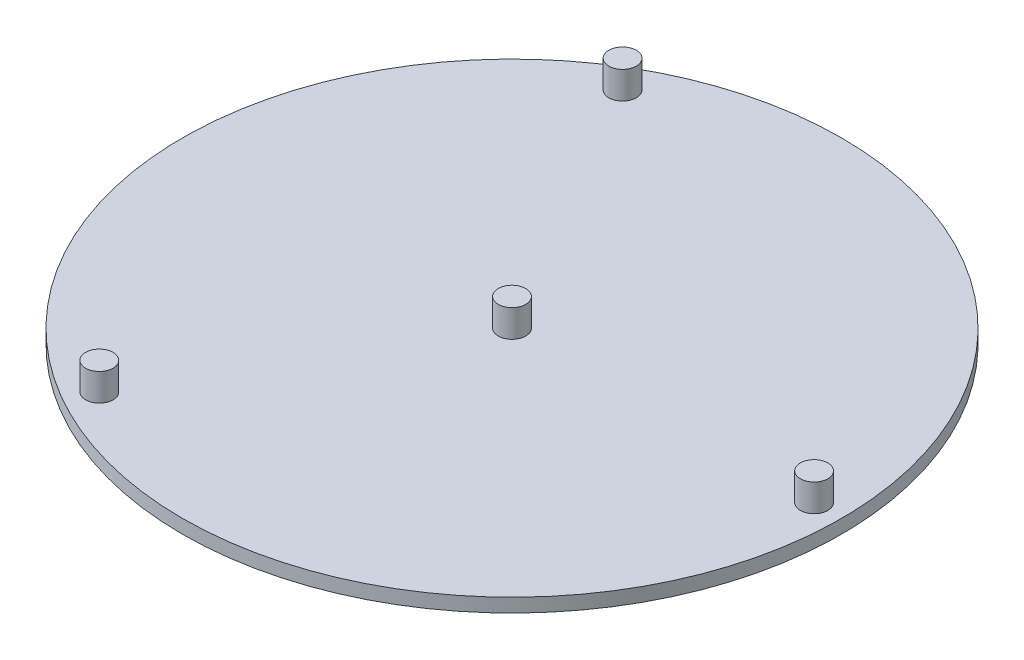
from build123d import *

# Parameters (mm, degrees)
SKETCH1_R           = 76.2
BOSS_EXTRUDE1_DEPTH = 3.175
SKETCH3_R           = 3.175
BOSS_EXTRUDE2_DEPTH = 6.35
CIRPATTERN1_COUNT   = 3


with BuildPart() as part:
    # Sketch1 → Boss-Extrude1 (new body)
    with BuildSketch(Plane(origin=(0, 0, 0), x_dir=(1, 0, 0), z_dir=(0, 1, 0))):
        with Locations(Location((0, 0, 0), (0, 0, 270))):
            Circle(SKETCH1_R)
    extrude(amount=BOSS_EXTRUDE1_DEPTH)

    # Sketch3 → Boss-Extrude2 (add)
    with BuildSketch(Plane(origin=(0, 3.175, 0), x_dir=(1, 0, 0), z_dir=(0, 1, 0))):
        with Locations(Location((0, 0, 0), (0, 0, 270))):
            Circle(SKETCH3_R)
        with Locations(Location((69.85, 0, 0), (0, 0, 270))):
            Circle(SKETCH3_R)
    boss_extrude2 = extrude(amount=BOSS_EXTRUDE2_DEPTH)

    # CirPattern1: Boss-Extrude2 ×3 about axis
    cirpattern1_axis = Axis((0, 0, 0), (0, 1, 0))
    for i in range(1, CIRPATTERN1_COUNT):
        add(boss_extrude2.rotate(cirpattern1_axis, i * 360 / CIRPATTERN1_COUNT))


solid = part.part
